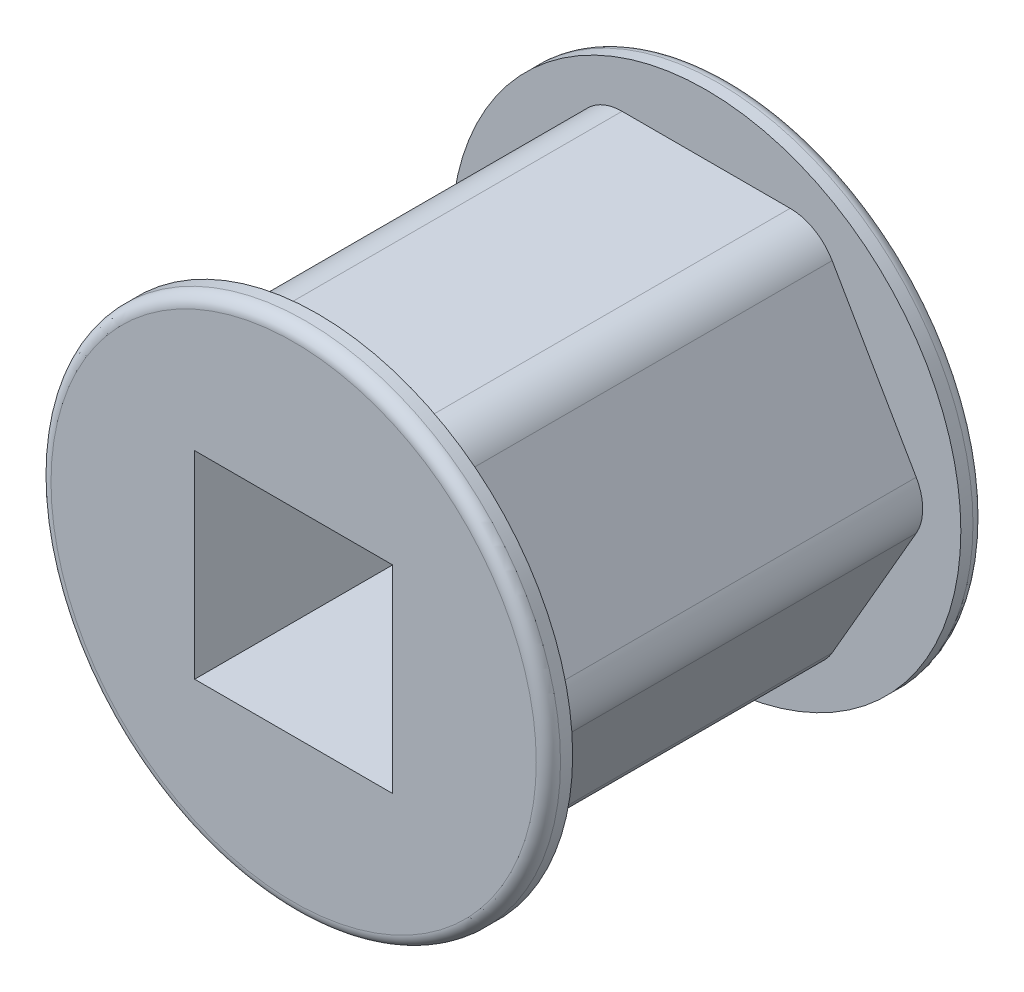
from build123d import *

# Parameters (mm, degrees)
SKETCH1_R           = 8.334375
SKETCH1_W           = 6.477
SKETCH1_H           = 6.477
BOSS_EXTRUDE1_DEPTH = 0.79375
SKETCH2_W           = 6.477
SKETCH2_H           = 6.477
BOSS_EXTRUDE2_DEPTH = 6.35
SKETCH3_R           = 5.1435
CUT_EXTRUDE1_DEPTH  = 1.27
FILLET1_R           = 1.5875
FILLET2_R           = 0.396875
SKETCH5_R           = 5.1435
SKETCH5_W           = 6.477
SKETCH5_H           = 6.477
BOSS_EXTRUDE3_DEPTH = 1.27
BOSS_EXTRUDE4_START = 1.27
SKETCH6_R           = 5.1435
SKETCH6_W           = 6.477
SKETCH6_H           = 6.477
BOSS_EXTRUDE4_DEPTH = 1.27


with BuildPart() as part:
    # Sketch1 → Boss-Extrude1 (new body)
    with BuildSketch(Plane.XY):
        Circle(SKETCH1_R)
        Rectangle(SKETCH1_W, SKETCH1_H, mode=Mode.SUBTRACT)
    extrude(amount=BOSS_EXTRUDE1_DEPTH)

    # Sketch2 → Boss-Extrude2 (add)
    with BuildSketch(Plane.XY.offset(0.79375)):
        Polygon((7.332348419, 0), (3.666174209, 6.35), (-3.666174209, 6.35), (-7.332348419, 0), (-3.666174209, -6.35), (3.666174209, -6.35), align=None)
        Rectangle(SKETCH2_W, SKETCH2_H, mode=Mode.SUBTRACT)
    extrude(amount=BOSS_EXTRUDE2_DEPTH)

    # Sketch3 → Cut-Extrude1 (cut)
    with BuildSketch(Plane(origin=(0, 0, 0), x_dir=(-1, 0, 0), z_dir=(0, 0, -1))):
        Circle(SKETCH3_R)
    extrude(amount=-CUT_EXTRUDE1_DEPTH, mode=Mode.SUBTRACT)

    # Fillet1
    fillet1_edges = [part.edges().sort_by_distance(p)[0] for p in [
        (3.666174209, -6.35, 3.96875),
        (7.332348419, 0, 3.96875),
        (3.666174209, 6.35, 3.96875),
        (-3.666174209, 6.35, 3.96875),
        (-7.332348419, 0, 3.96875),
        (-3.666174209, -6.35, 3.96875),
    ]]
    fillet(fillet1_edges, radius=FILLET1_R)

    # Fillet2
    fillet2_edges = [part.edges().sort_by_distance(p)[0] for p in [
        (-8.334375, 0, 0),
    ]]
    fillet(fillet2_edges, radius=FILLET2_R)

    # Mirror1: part across plane


with BuildPart() as part_1:
    add(part.part)
    add(part.part.mirror(Plane.XY.offset(7.14375)))

    # Sketch5 → Boss-Extrude3 (add)
    with BuildSketch(Plane(origin=(0, 0, 1.27), x_dir=(-1, 0, 0), z_dir=(0, 0, -1))):
        Circle(SKETCH5_R)
        Rectangle(SKETCH5_W, SKETCH5_H, mode=Mode.SUBTRACT)
    extrude(amount=BOSS_EXTRUDE3_DEPTH)

    # Sketch6 → Boss-Extrude4 (add)
    with BuildSketch(Plane.XY.offset(13.0175).offset(BOSS_EXTRUDE4_START)):
        Circle(SKETCH6_R)
        Rectangle(SKETCH6_W, SKETCH6_H, mode=Mode.SUBTRACT)
    extrude(amount=-BOSS_EXTRUDE4_DEPTH)


solid = part_1.part
